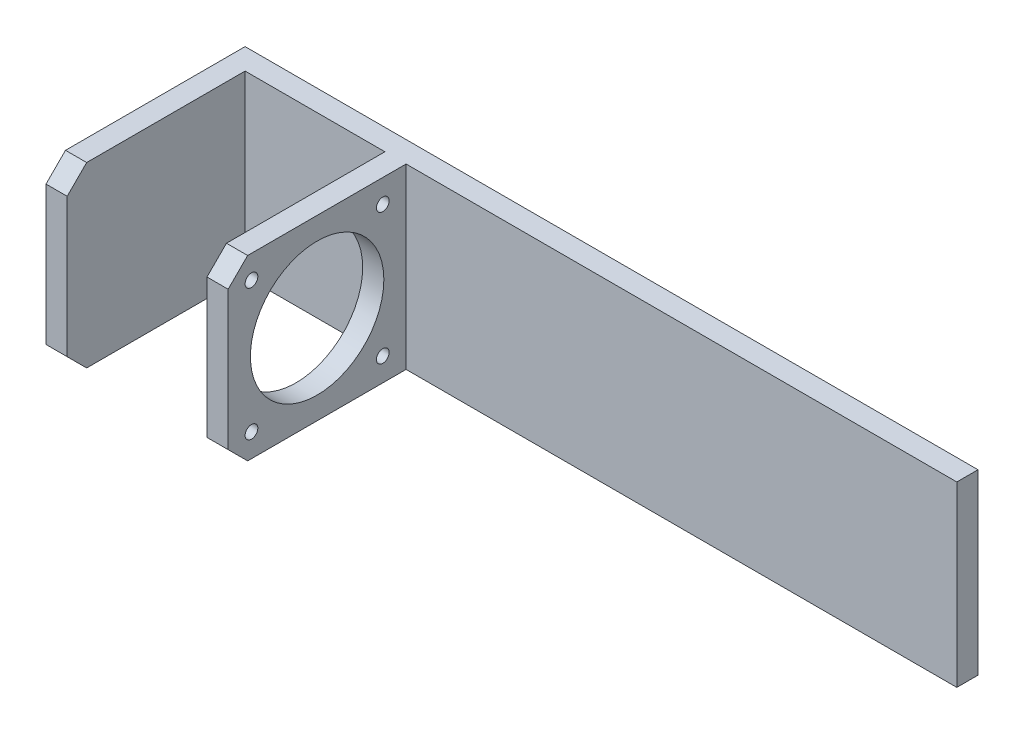
from build123d import *

# Parameters (mm, degrees)
BOSS_EXTRUDE1_DEPTH = 5
BOSS_EXTRUDE3_DEPTH = 5
SKETCH5_W           = 5
SKETCH5_H           = 42
BOSS_EXTRUDE4_DEPTH = 33
SKETCH6_W           = 5
SKETCH6_H           = 42
BOSS_EXTRUDE5_DEPTH = 5
SKETCH7_W           = 5
SKETCH7_H           = 42
BOSS_EXTRUDE6_DEPTH = 130


with BuildPart() as part:
    # Sketch2 → Boss-Extrude1 (new body)
    with BuildSketch(Plane(origin=(0, 0, 0), x_dir=(0, 0, -1), z_dir=(1, 0, 0))):
        Polygon((-21, 16.4), (-21, -16.4), (-16.4, -21), (16.4, -21), (21, -16.4), (21, 16.4), (16.4, 21), (-16.4, 21), align=None)
        with BuildLine():
            ThreePointArc((-14, 15.5), (-15.5, 17), (-17, 15.5))
            ThreePointArc((-17, 15.5), (-15.5, 14), (-14, 15.5))
        make_face(mode=Mode.SUBTRACT)
        with BuildLine():
            ThreePointArc((15.75, 0), (0, 15.75), (-15.75, 0))
            ThreePointArc((-15.75, 0), (0, -15.75), (15.75, 0))
        make_face(mode=Mode.SUBTRACT)
        with BuildLine():
            ThreePointArc((17, -15.5), (15.5, -14), (14, -15.5))
            ThreePointArc((14, -15.5), (15.5, -17), (17, -15.5))
        make_face(mode=Mode.SUBTRACT)
        with BuildLine():
            ThreePointArc((17, 15.5), (15.5, 17), (14, 15.5))
            ThreePointArc((14, 15.5), (15.5, 14), (17, 15.5))
        make_face(mode=Mode.SUBTRACT)
        with BuildLine():
            ThreePointArc((-14, -15.5), (-15.5, -14), (-17, -15.5))
            ThreePointArc((-17, -15.5), (-15.5, -17), (-14, -15.5))
        make_face(mode=Mode.SUBTRACT)
    extrude(amount=BOSS_EXTRUDE1_DEPTH)

    # Sketch4 → Boss-Extrude3 (add)
    with BuildSketch(Plane(origin=(5, 0, 0), x_dir=(0, 0, -1), z_dir=(1, 0, 0))):
        Polygon((26, 21), (26, -21), (16.4, -21), (21, -16.4), (21, 16.4), (16.4, 21), align=None)
    extrude(amount=-BOSS_EXTRUDE3_DEPTH)

    # Sketch5 → Boss-Extrude4 (add)
    with BuildSketch(Plane.ZY):
        with Locations((-23.5, 0)):
            Rectangle(SKETCH5_W, SKETCH5_H)
    extrude(amount=BOSS_EXTRUDE4_DEPTH)

    # Sketch6 → Boss-Extrude5 (add)
    with BuildSketch(Plane.ZY.offset(33)):
        with Locations((-23.5, 0)):
            Rectangle(SKETCH6_W, SKETCH6_H)
        Polygon((21, 16.4), (16.4, 21), (-21, 21), (-21, -21), (16.4, -21), (21, -16.4), align=None)
    extrude(amount=BOSS_EXTRUDE5_DEPTH)

    # Sketch7 → Boss-Extrude6 (add)
    with BuildSketch(Plane(origin=(5, 0, 0), x_dir=(0, 0, -1), z_dir=(1, 0, 0))):
        with Locations((23.5, 0)):
            Rectangle(SKETCH7_W, SKETCH7_H)
    extrude(amount=BOSS_EXTRUDE6_DEPTH)


solid = part.part
